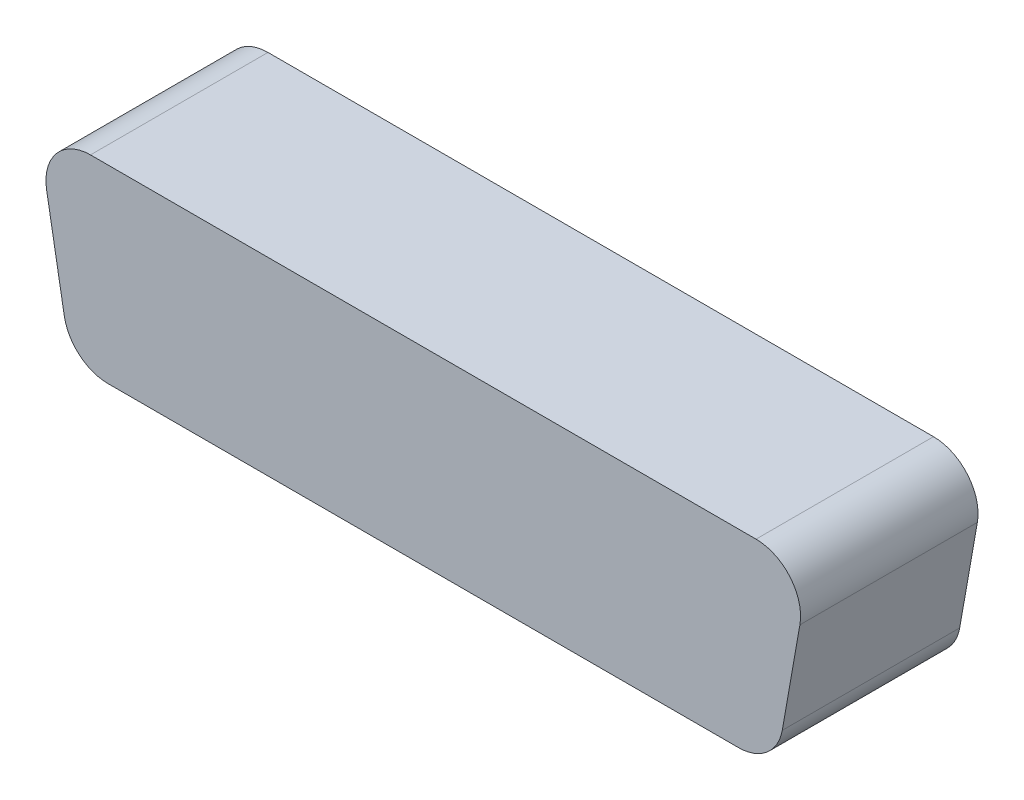
from build123d import *

# Parameters (mm, degrees)
BOSS_EXTRUDE1_DEPTH = 10


with BuildPart() as part:
    # Sketch1 → Boss-Extrude1 (new body)
    with BuildSketch(Plane.XY):
        with BuildLine():
            Line((-18.750494787, 10.668), (18.750494787, 10.668))
            ThreePointArc((18.750494787, 10.668), (20.673266339, 9.7713969), (21.222362247, 7.722143074))
            Line((21.222362247, 7.722143074), (20.22646746, 2.074143074))
            ThreePointArc((20.22646746, 2.074143074), (19.3679969, 0.587228448), (17.7546, 0))
            Line((17.7546, 0), (-17.7546, 0))
            ThreePointArc((-17.7546, 0), (-19.3679969, 0.587228448), (-20.22646746, 2.074143074))
            Line((-20.22646746, 2.074143074), (-21.222362247, 7.722143074))
            ThreePointArc((-21.222362247, 7.722143074), (-20.673266339, 9.7713969), (-18.750494787, 10.668))
        make_face()
    extrude(amount=BOSS_EXTRUDE1_DEPTH)


solid = part.part
